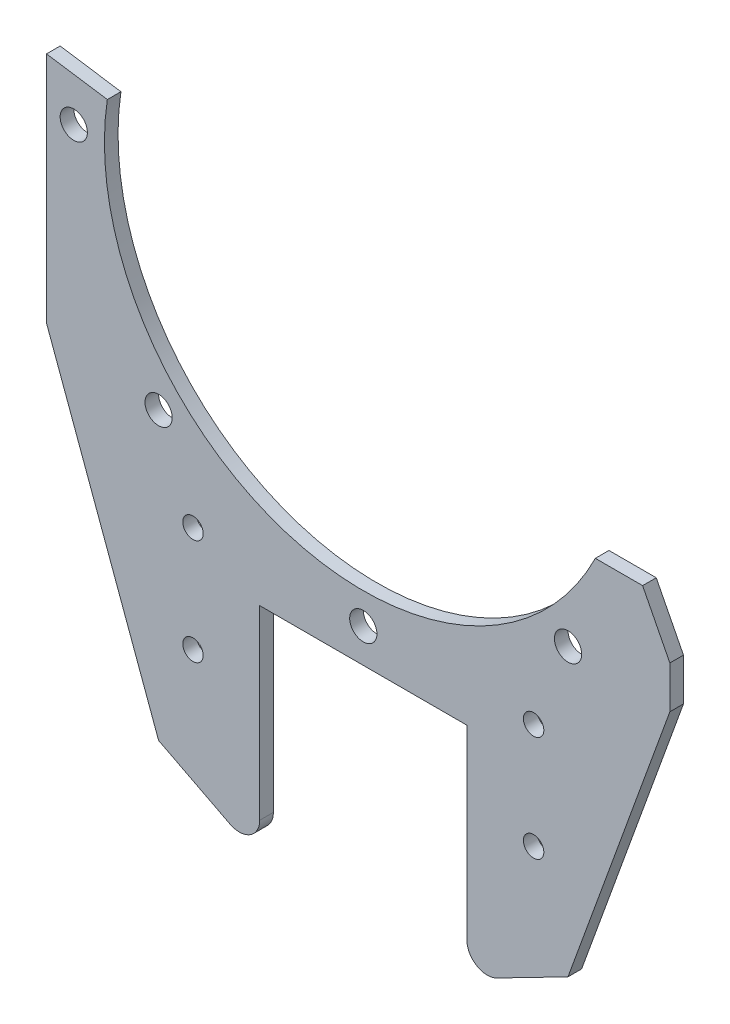
from build123d import *

# Parameters (mm, degrees)
SKETCH_3_R      = 2
SKETCH_3_R_2    = 1.5
EXTRUDE_1_DEPTH = 2


with BuildPart() as part:
    # 草图3 → 凸台-拉伸1 (new body)
    with BuildSketch(Plane.XY):
        with BuildLine():
            Line((-46.5, 63), (-37.576612526, 61.656694359))
            ThreePointArc((-37.576612526, 61.656694359), (-11.38853896, 19.746708007), (34.06116735, 39.152540881))
            Line((34.06116735, 39.152540881), (41, 39.152540881))
            Line((41, 39.152540881), (45, 31.317051182))
            Line((45, 31.317051182), (45, 25.109783315))
            Line((45, 25.109783315), (30.045120352, -16.062768097))
            Line((30.045120352, -16.062768097), (19.571056376, -21.44452782))
            ThreePointArc((19.571056376, -21.44452782), (16.636857193, -21.33673956), (15.2, -18.776156704))
            Line((15.2, -18.776156704), (15.2, 8.509783315))
            Line((15.2, 8.509783315), (0, 8.509783315))
            Line((0, 8.509783315), (-15.2, 8.509783315))
            Line((-15.2, 8.509783315), (-15.2, -18.776156704))
            ThreePointArc((-15.2, -18.776156704), (-16.636857193, -21.33673956), (-19.571056376, -21.44452782))
            Line((-19.571056376, -21.44452782), (-30.045120352, -16.062768097))
            Line((-30.045120352, -16.062768097), (-46.5, 28.773494756))
            Line((-46.5, 28.773494756), (-46.5, 63))
        make_face()
        with Locations((0, 13.5)):
            Circle(SKETCH_3_R, mode=Mode.SUBTRACT)
        with Locations((-42.5, 56)):
            Circle(SKETCH_3_R, mode=Mode.SUBTRACT)
        with Locations((30.0520382, 25.9479618)):
            Circle(SKETCH_3_R, mode=Mode.SUBTRACT)
        with Locations((-30.045120352, 25.954879648)):
            Circle(SKETCH_3_R, mode=Mode.SUBTRACT)
        with Locations((-25, -1.990216685)):
            Circle(SKETCH_3_R_2, mode=Mode.SUBTRACT)
        with Locations((-25, 13.509783315)):
            Circle(SKETCH_3_R_2, mode=Mode.SUBTRACT)
        with Locations(Location((25, 13.509783315, 0), (0, 0, 180))):
            Circle(SKETCH_3_R_2, mode=Mode.SUBTRACT)
        with Locations(Location((25, -1.990216685, 0), (0, 0, 180))):
            Circle(SKETCH_3_R_2, mode=Mode.SUBTRACT)
    extrude(amount=EXTRUDE_1_DEPTH)


solid = part.part
